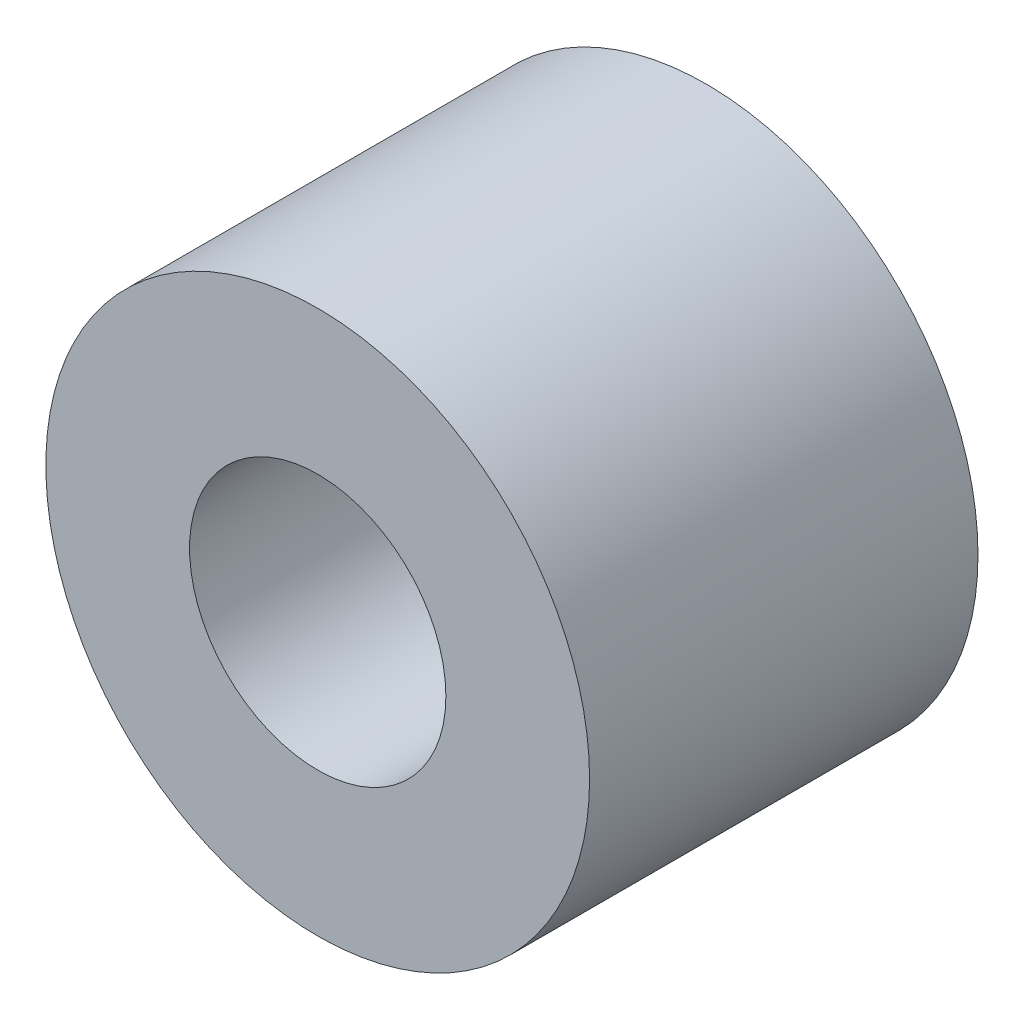
from build123d import *

# Parameters (mm, degrees)
SKETCH_1_R      = 3.5
SKETCH_1_R_2    = 1.65
EXTRUDE_1_DEPTH = 5


with BuildPart() as part:
    # ｽｹｯﾁ1 → ﾎﾞｽ - 押し出し1 (new body)
    with BuildSketch(Plane.XY):
        Circle(SKETCH_1_R)
        Circle(SKETCH_1_R_2, mode=Mode.SUBTRACT)
    extrude(amount=EXTRUDE_1_DEPTH)


solid = part.part
